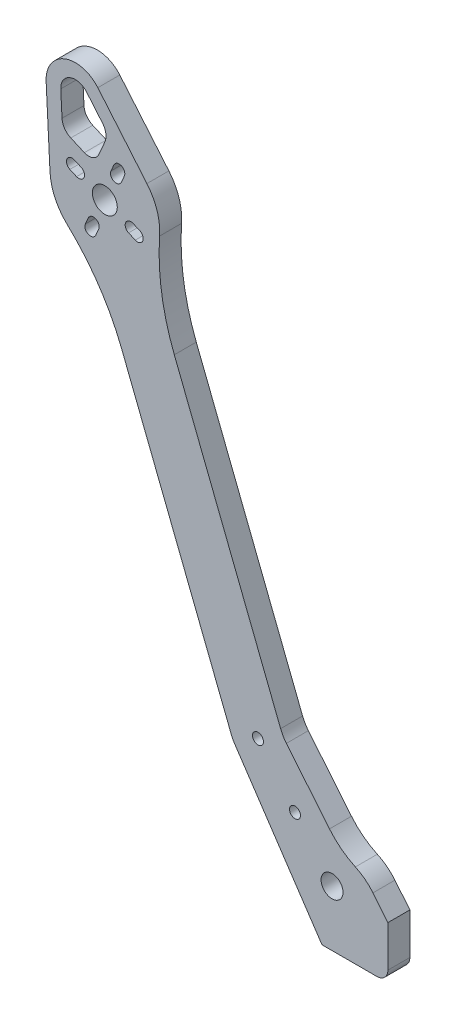
from build123d import *

# Parameters (mm, degrees)
CROQUIS1_R              = 3.4
CROQUIS1_R_2            = 3
CROQUIS1_R_3            = 1.5
CROQUIS1_R_4            = 1.500001004
SALIENTE_EXTRUIR1_DEPTH = 6


with BuildPart() as part:
    # Croquis1 → Saliente-Extruir1 (new body)
    with BuildSketch(Plane.XY):
        with BuildLine():
            Line((-29.303608517, 45.473325839), (-58.336924517, 119.389926839))
            ThreePointArc((-58.336924517, 119.389926839), (-61.793103757, 132.204361213), (-62.347490923, 145.46511376))
            ThreePointArc((-62.347490923, 145.46511376), (-63.047561651, 151.140362617), (-65.820602243, 156.141241988))
            Line((-65.820602243, 156.141241988), (-79.226205243, 172.119032988))
            ThreePointArc((-79.226205243, 172.119032988), (-88.279569401, 174.423233147), (-93.344634593, 166.573528977))
            Line((-93.344634593, 166.573528977), (-92.292655243, 145.743421988))
            ThreePointArc((-92.292655243, 145.743421988), (-90.920958081, 140.192116496), (-87.571476882, 135.557516032))
            ThreePointArc((-87.571476882, 135.557516032), (-78.952780907, 125.464301499), (-72.763926988, 113.723220326))
            Line((-72.763926988, 113.723220326), (-42.706743988, 37.199930326))
            ThreePointArc((-42.706743988, 37.199930326), (-42.359256153, 36.438795137), (-41.931739661, 35.719556497))
            Line((-41.931739661, 35.719556497), (-17.999999661, 4.97e-07))
            Line((-17.999999661, 4.97e-07), (-2.999999661, 4.97e-07))
            ThreePointArc((-2.999999661, 4.97e-07), (-0.878679318, 0.878680154), (3.39e-07, 3.000000497))
            Line((3.39e-07, 3.000000497), (3.39e-07, 14.250000497))
            Line((3.39e-07, 14.250000497), (-4.079708661, 19.244683497))
            ThreePointArc((-4.079708661, 19.244683497), (-6.27155818, 21.381766981), (-8.886999737, 22.972614423))
            ThreePointArc((-8.886999737, 22.972614423), (-12.726828858, 25.305121653), (-15.949120882, 28.435890212))
            Line((-15.949120882, 28.435890212), (-27.725819882, 42.785152212))
            ThreePointArc((-27.725819882, 42.785152212), (-28.620096035, 44.067386525), (-29.303608517, 45.473325839))
        make_face()
        with Locations((-77.311748512, 146.499999762)):
            Circle(CROQUIS1_R, mode=Mode.SUBTRACT)
        with Locations((-15.25, 15.25)):
            Circle(CROQUIS1_R_2, mode=Mode.SUBTRACT)
        with Locations((-25.371621, 27.641642)):
            Circle(CROQUIS1_R_3, mode=Mode.SUBTRACT)
        with Locations((-35.49324282, 40.033285892)):
            Circle(CROQUIS1_R_4, mode=Mode.SUBTRACT)
        with BuildLine():
            Line((-71.99439, 154.818095), (-72.793676, 152.984753))
            ThreePointArc((-72.793676, 152.984753), (-74.833795849, 152.18374175), (-75.635356, 154.223646))
            Line((-75.635356, 154.223646), (-74.836069921, 156.056987462))
            ThreePointArc((-74.836069921, 156.056987462), (-72.795783729, 156.858381191), (-71.99439, 154.818095))
        make_face(mode=Mode.SUBTRACT)
        with BuildLine():
            Line((-86.868735462, 148.975678079), (-85.035394, 148.176392))
            ThreePointArc((-85.035394, 148.176392), (-82.9951075, 148.9777855), (-83.796501, 151.018072))
            Line((-83.796501, 151.018072), (-85.629843, 151.817358))
            ThreePointArc((-85.629843, 151.817358), (-87.669747153, 151.015797712), (-86.868735462, 148.975678079))
        make_face(mode=Mode.SUBTRACT)
        with BuildLine():
            Line((-67.754760538, 144.024321921), (-69.588102, 144.823608))
            ThreePointArc((-69.588102, 144.823608), (-71.62800625, 144.022047849), (-70.826995, 141.981928))
            Line((-70.826995, 141.981928), (-68.993653, 141.182642))
            ThreePointArc((-68.993653, 141.182642), (-66.953366809, 141.98403573), (-67.754760538, 144.024321921))
        make_face(mode=Mode.SUBTRACT)
        with BuildLine():
            Line((-82.89780493, 154.919280048), (-86.61137993, 156.538295048))
            ThreePointArc((-86.61137993, 156.538295048), (-88.302670061, 157.929718336), (-89.007717, 160.003225))
            Line((-89.007717, 160.003225), (-89.349725675, 166.775282995))
            ThreePointArc((-89.349725675, 166.775282995), (-86.817213433, 170.700127324), (-82.290539057, 169.548068144))
            Line((-82.290539057, 169.548068144), (-77.926769806, 164.347120835))
            ThreePointArc((-77.926769806, 164.347120835), (-77.036994499, 162.350360642), (-77.32981093, 160.184025048))
            Line((-77.32981093, 160.184025048), (-78.94886318, 156.470364412))
            ThreePointArc((-78.94886318, 156.470364412), (-80.602093919, 154.876969498), (-82.89780493, 154.919280048))
        make_face(mode=Mode.SUBTRACT)
        with BuildLine():
            Line((-82.629106, 138.181905), (-81.82982, 140.015247))
            ThreePointArc((-81.82982, 140.015247), (-79.7895335, 140.8166405), (-78.98814, 138.776354))
            Line((-78.98814, 138.776354), (-79.787426079, 136.943012538))
            ThreePointArc((-79.787426079, 136.943012538), (-81.827545712, 136.142000847), (-82.629106, 138.181905))
        make_face(mode=Mode.SUBTRACT)
    extrude(amount=SALIENTE_EXTRUIR1_DEPTH)


solid = part.part
